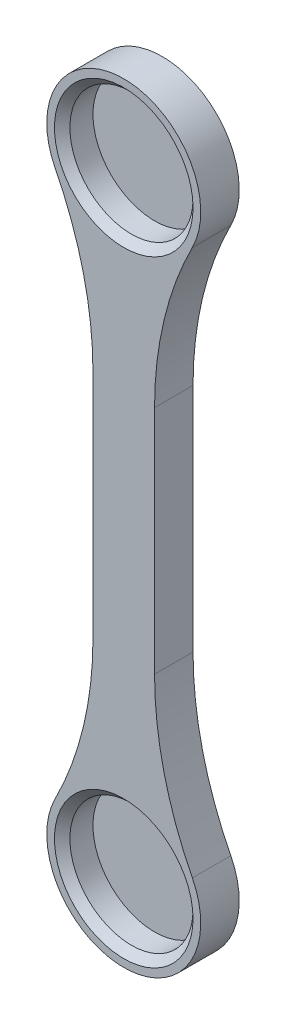
from build123d import *
from build123d.topology import SkipClean

# Parameters (mm, degrees)
BOSS_EXTRU_1_DEPTH      = 5
ESQUISSE2_R             = 8
ENL_V_MAT_EXTRU_1_DEPTH = 4
ENL_V_MAT_EXTRU_2_DEPTH = 91.691785736
CHANFREIN1_SIZE         = 1


with BuildPart() as part:
    # Esquisse1 → Boss.-Extru.1 (new body)
    with BuildSketch(Plane.XY):
        with BuildLine():
            Line((-10, 0), (-10, 80))
            ThreePointArc((-10, 80), (0, 90), (10, 80))
            Line((10, 80), (10, 0))
            ThreePointArc((10, 0), (0, -10), (-10, 0))
        make_face()
    extrude(amount=BOSS_EXTRU_1_DEPTH)

    # Esquisse2 → Enlèv. mat.-Extru.1 (cut)
    with BuildSketch(Plane.XY.offset(5)):
        Circle(ESQUISSE2_R)
        with Locations((0, 80)):
            Circle(ESQUISSE2_R)
    extrude(amount=-ENL_V_MAT_EXTRU_1_DEPTH, mode=Mode.SUBTRACT)

    # Esquisse3 → Enlèv. mat.-Extru.2 (cut, through all)
    with SkipClean():  # the faces are left unmerged after this step: merging them gives an invalid solid
        with BuildSketch(Plane.XY.offset(5)):
            with BuildLine():
                Line((-4, 55), (-4, 25))
                ThreePointArc((-4, 25), (-5.244872469, 14.478769393), (-8.910741301, 4.538577912))
                ThreePointArc((-8.910741301, 4.538577912), (-9.72387302, 2.333729525), (-10, 0))
                Line((-10, 0), (-10, 80))
                ThreePointArc((-10, 80), (-9.72387302, 77.666270475), (-8.910741301, 75.461422088))
                ThreePointArc((-8.910741301, 75.461422088), (-5.244872469, 65.521230607), (-4, 55))
            make_face()
            with BuildLine():
                Line((4, 55), (4, 25))
                ThreePointArc((4, 25), (5.244872469, 14.478769393), (8.910741301, 4.538577912))
                ThreePointArc((8.910741301, 4.538577912), (9.72387302, 2.333729525), (10, 0))
                Line((10, 0), (10, 80))
                ThreePointArc((10, 80), (9.72387302, 77.666270475), (8.910741301, 75.461422088))
                ThreePointArc((8.910741301, 75.461422088), (5.244872469, 65.521230607), (4, 55))
            make_face()
        extrude(amount=-ENL_V_MAT_EXTRU_2_DEPTH, mode=Mode.SUBTRACT)

    # Chanfrein1
    chanfrein1_edges = [part.edges().sort_by_distance(p)[0] for p in [
        (-8, 0, 5),
        (-8, 80, 5),
    ]]
    chamfer(chanfrein1_edges, length=CHANFREIN1_SIZE)


solid = part.part
